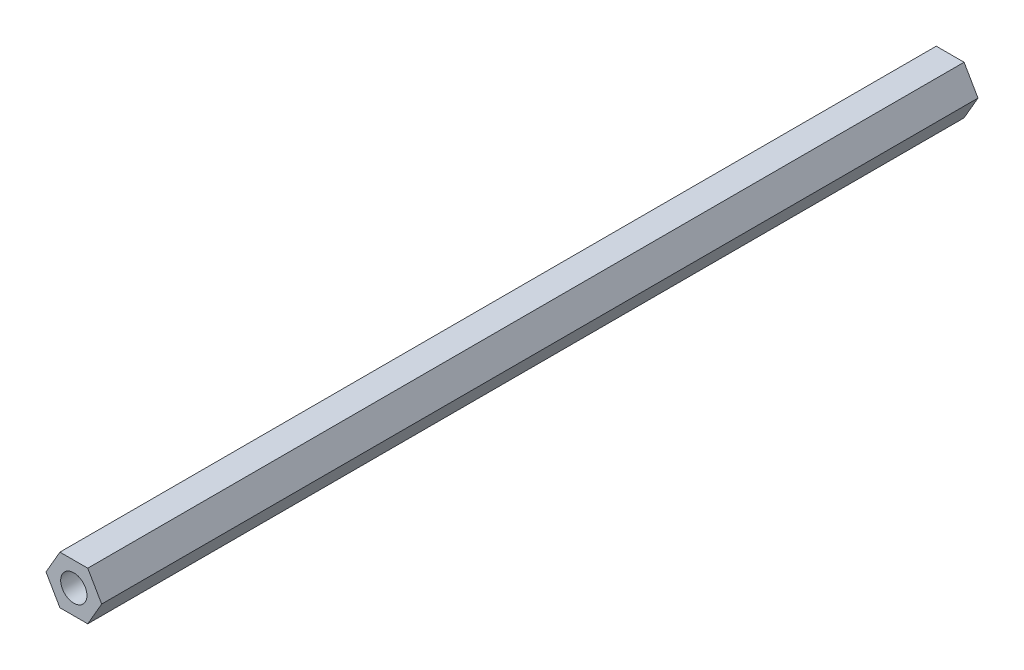
from build123d import *

# Parameters (mm, degrees)
EXTRUDE_1_DEPTH     = 100
SKETCH_2_R          = 1.5
CUT_EXTRUDE_1_DEPTH = 10
CUT_EXTRUDE_START   = -10
SKETCH_3_R          = 1.5
CUT_EXTRUDE_2_DEPTH = 10


with BuildPart() as part:
    # Эскиз1 → Бобышка-Вытянуть1 (new body)
    with BuildSketch(Plane.XY):
        Polygon((1.58771324, -2.75), (3.175426481, 0), (1.58771324, 2.75), (-1.58771324, 2.75), (-3.175426481, 0), (-1.58771324, -2.75), align=None)
    extrude(amount=EXTRUDE_1_DEPTH)

    # Эскиз2 → Вырез-Вытянуть1 (cut)
    with BuildSketch(Plane(origin=(0, 0, 0), x_dir=(-1, 0, 0), z_dir=(0, 0, -1))):
        Circle(SKETCH_2_R)
    extrude(amount=-CUT_EXTRUDE_1_DEPTH, mode=Mode.SUBTRACT)

    # Эскиз3 → Вырез-Вытянуть2 (cut)
    with BuildSketch(Plane.XY.offset(100).offset(CUT_EXTRUDE_START)):
        with Locations(Location((0, 0, 0), (0, 0, 180))):
            Circle(SKETCH_3_R)
    extrude(amount=CUT_EXTRUDE_2_DEPTH, mode=Mode.SUBTRACT)


solid = part.part
